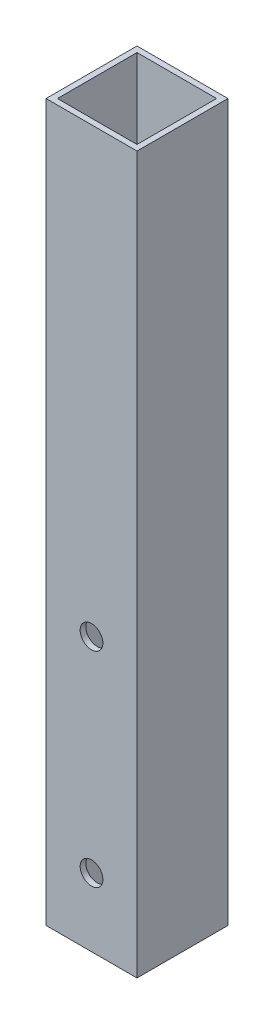
from build123d import *

# Parameters (mm, degrees)
SKETCH1_W           = 25.4
SKETCH1_H           = 25.4
SKETCH1_W_2         = 22.225
SKETCH1_H_2         = 22.225
BOSS_EXTRUDE1_DEPTH = 200
SKETCH2_R           = 3.175
CUT_EXTRUDE1_DEPTH  = 203.006064265


with BuildPart() as part:
    # Sketch1 → Boss-Extrude1 (new body)
    with BuildSketch(Plane(origin=(0, 0, 0), x_dir=(1, 0, 0), z_dir=(0, 1, 0))):
        Rectangle(SKETCH1_W, SKETCH1_H)
        Rectangle(SKETCH1_W_2, SKETCH1_H_2, mode=Mode.SUBTRACT)
    extrude(amount=BOSS_EXTRUDE1_DEPTH)

    # Sketch2 → Cut-Extrude1 (cut, through all)
    with BuildSketch(Plane(origin=(0, 0, -12.7), x_dir=(-1, 0, 0), z_dir=(0, 0, -1))):
        with Locations((0, 76.2)):
            Circle(SKETCH2_R)
        with Locations((0, 19.05)):
            Circle(SKETCH2_R)
    extrude(amount=-CUT_EXTRUDE1_DEPTH, mode=Mode.SUBTRACT)


solid = part.part
